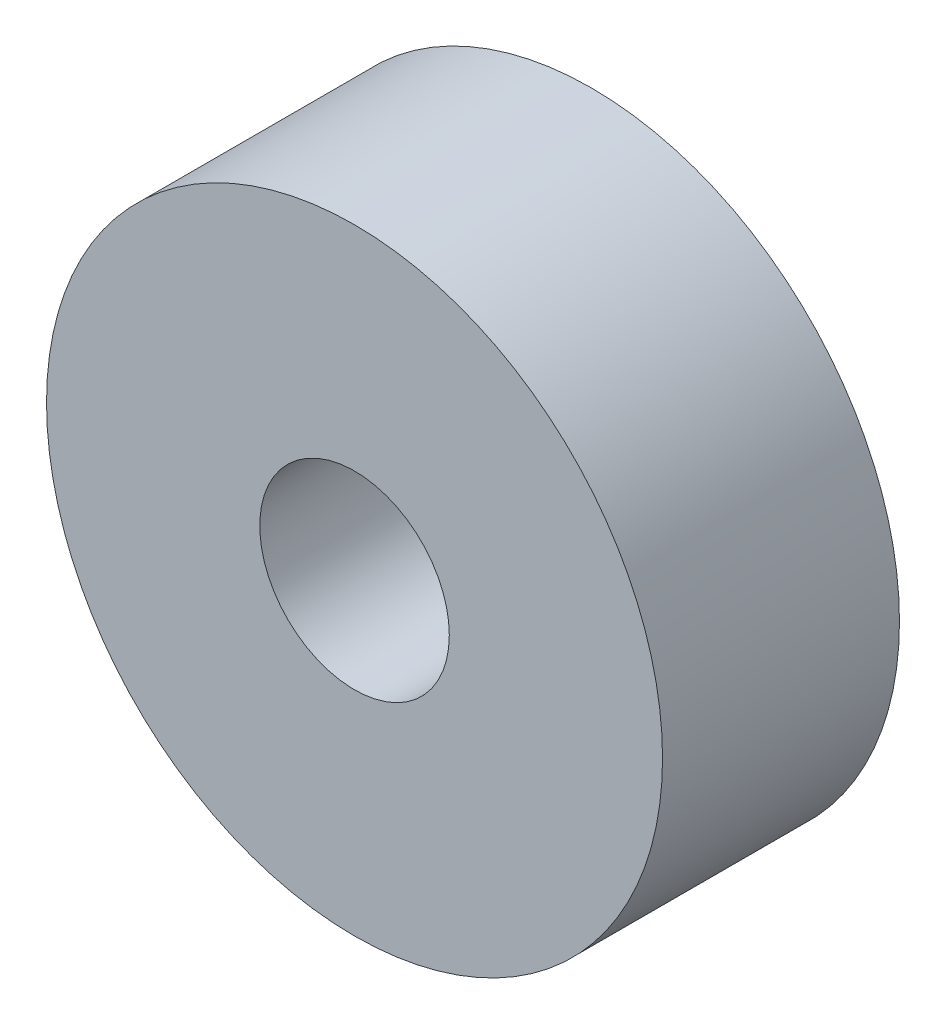
from build123d import *

# Parameters (mm, degrees)
SKETCH1_R           = 6.5
SKETCH1_R_2         = 2
BOSS_EXTRUDE1_DEPTH = 5


with BuildPart() as part:
    # Sketch1 → Boss-Extrude1 (new body)
    with BuildSketch(Plane.XY):
        Circle(SKETCH1_R)
        Circle(SKETCH1_R_2, mode=Mode.SUBTRACT)
    extrude(amount=BOSS_EXTRUDE1_DEPTH)


solid = part.part
